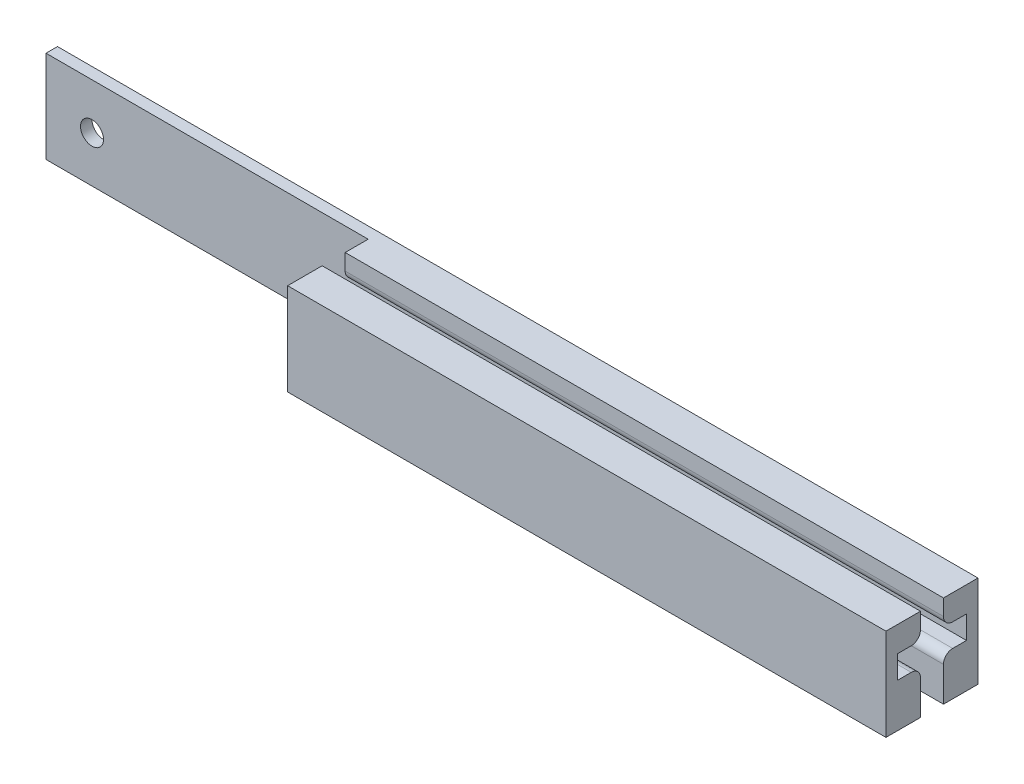
from build123d import *

# Parameters (mm, degrees)
BOSS_EXTRUDE1_DEPTH = 650
SKETCH2_W           = 700
SKETCH2_H           = 25
CUT_EXTRUDE1_DEPTH  = 800
FILLET1_R           = 10
SKETCH3_W           = 12.5
SKETCH3_H           = 100
BOSS_EXTRUDE2_DEPTH = 350
SKETCH4_R           = 12.5
CUT_EXTRUDE2_DEPTH  = 350


with BuildPart() as part:
    # Sketch1 → Boss-Extrude1 (new body)
    with BuildSketch(Plane(origin=(0, 0, 0), x_dir=(0, 0, -1), z_dir=(1, 0, 0))):
        Polygon((-100, 0), (0, 0), (0, 100), (-37.5, 100), (-37.5, 72.5), (-12.5, 72.5), (-12.5, 47.5), (-37.5, 47.5), (-37.5, 20), (-62.5, 20), (-62.5, 47.5), (-87.5, 47.5), (-87.5, 72.5), (-62.5, 72.5), (-62.5, 100), (-100, 100), align=None)
    extrude(amount=BOSS_EXTRUDE1_DEPTH)

    # Sketch2 → Cut-Extrude1 (cut)
    with BuildSketch(Plane.XZ):
        with Locations((400, 50)):
            Rectangle(SKETCH2_W, SKETCH2_H)
    extrude(amount=-CUT_EXTRUDE1_DEPTH, mode=Mode.SUBTRACT)

    # Fillet1
    fillet1_edges = [part.edges().sort_by_distance(p)[0] for p in [
        (325, 72.5, 37.5),
        (325, 72.5, 62.5),
        (325, 47.5, 62.5),
        (325, 47.5, 37.5),
    ]]
    fillet(fillet1_edges, radius=FILLET1_R)

    # Sketch3 → Boss-Extrude2 (add)
    with BuildSketch(Plane.ZY):
        with Locations((6.25, 50)):
            Rectangle(SKETCH3_W, SKETCH3_H)
    extrude(amount=BOSS_EXTRUDE2_DEPTH)

    # Sketch4 → Cut-Extrude2 (cut)
    with BuildSketch(Plane.XY.offset(12.5)):
        with Locations((-300, 50)):
            Circle(SKETCH4_R)
    extrude(amount=-CUT_EXTRUDE2_DEPTH, mode=Mode.SUBTRACT)


solid = part.part
